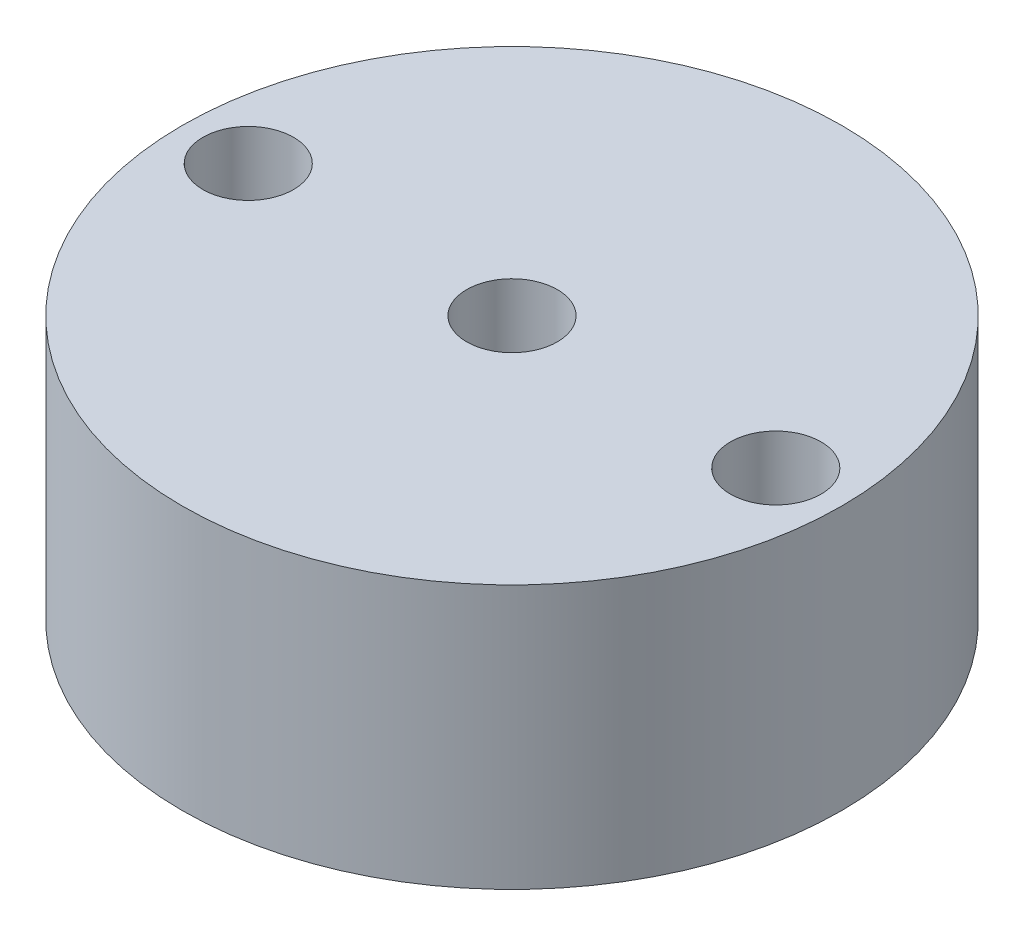
from build123d import *

# Parameters (mm, degrees)
SKETCH1_R           = 15.875
SKETCH1_R_2         = 2.1828125
BOSS_EXTRUDE1_DEPTH = 12.7


with BuildPart() as part:
    # Sketch1 → Boss-Extrude1 (new body)
    with BuildSketch(Plane(origin=(0, 0, 0), x_dir=(1, 0, 0), z_dir=(0, 1, 0))):
        with Locations(Location((0, 0, 0), (0, 0, 270))):
            Circle(SKETCH1_R)
        with Locations(Location((0, 0, 0), (0, 0, 270))):
            Circle(SKETCH1_R_2, mode=Mode.SUBTRACT)
        with Locations(Location((12.7, 0, 0), (0, 0, 270))):
            Circle(SKETCH1_R_2, mode=Mode.SUBTRACT)
        with Locations(Location((-12.7, 0, 0), (0, 0, 270))):
            Circle(SKETCH1_R_2, mode=Mode.SUBTRACT)
    extrude(amount=BOSS_EXTRUDE1_DEPTH)


solid = part.part
